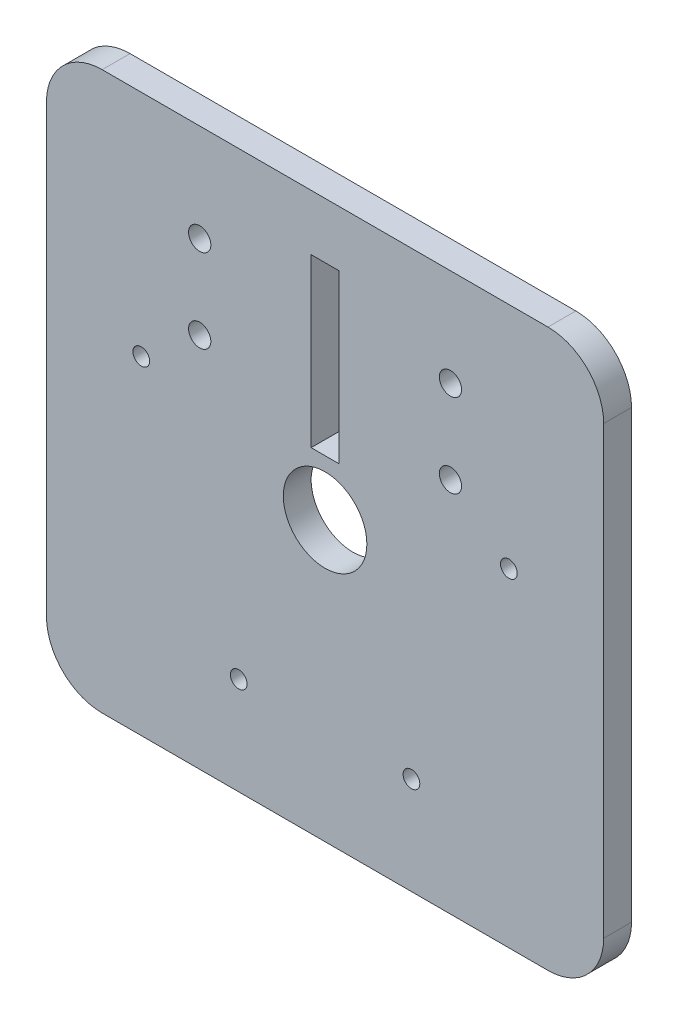
from build123d import *

# Parameters (mm, degrees)
CROQUIS1_W              = 100
CROQUIS1_H              = 100
CROQUIS1_R              = 7.5
CROQUIS1_W_2            = 5
CROQUIS1_H_2            = 30
SALIENTE_EXTRUIR1_DEPTH = 5
REDONDEO1_R             = 10
CROQUIS3_R              = 1.5
CROQUIS3_R_2            = 1.500000006
CORTAR_EXTRUIR1_DEPTH   = 5
CORTAR_EXTRUIR2_REACH   = 144.377
CROQUIS4_R              = 2


with BuildPart() as part:
    # Croquis1 → Saliente-Extruir1 (new body)
    with BuildSketch(Plane.XY):
        with Locations((-73.773233416, -20.188160544)):
            Rectangle(CROQUIS1_W, CROQUIS1_H)
        with Locations((-73.773233416, -20.188160544)):
            Circle(CROQUIS1_R, mode=Mode.SUBTRACT)
        with Locations((-73.773233416, 4.811839456)):
            Rectangle(CROQUIS1_W_2, CROQUIS1_H_2, mode=Mode.SUBTRACT)
    extrude(amount=SALIENTE_EXTRUIR1_DEPTH)

    # Redondeo1
    redondeo1_edges = [part.edges().sort_by_distance(p)[0] for p in [
        (-23.773233416, 29.811839456, 2.5),
        (-23.773233416, -70.188160544, 2.5),
        (-123.773233416, -70.188160544, 2.5),
        (-123.773233416, 29.811839456, 2.5),
    ]]
    fillet(redondeo1_edges, radius=REDONDEO1_R)

    # Croquis3 → Cortar-Extruir1 (cut)
    with BuildSketch(Plane(origin=(0, 0, 0), x_dir=(-1, 0, 0), z_dir=(0, 0, -1))):
        with Locations((106.757827558, -11.251647632)):
            Circle(CROQUIS3_R)
        with Locations((40.788639233, -11.251647632)):
            Circle(CROQUIS3_R_2)
        with Locations((89.273233395, -52.688161005)):
            Circle(CROQUIS3_R)
        with Locations((58.273233395, -52.688161005)):
            Circle(CROQUIS3_R)
    extrude(amount=-CORTAR_EXTRUIR1_DEPTH, mode=Mode.SUBTRACT)

    # Croquis4 → Cortar-Extruir2 (cut, up to next)
    with BuildSketch(Plane.XY.offset(5), mode=Mode.PRIVATE) as cortar_extruir2_sk1:
        with Locations((-51.273233416, 12.311839456)):
            Circle(CROQUIS4_R)
    cortar_extruir2_tool1 = extrude(cortar_extruir2_sk1.sketch, amount=-CORTAR_EXTRUIR2_REACH, mode=Mode.PRIVATE) & part.part
    # Croquis4 → Cortar-Extruir2 (cut, up to next)
    with BuildSketch(Plane.XY.offset(5), mode=Mode.PRIVATE) as cortar_extruir2_sk2:
        with Locations(Location((-96.273233416, 12.311839456, 0), (0, 0, 180))):
            Circle(CROQUIS4_R)
    cortar_extruir2_tool2 = extrude(cortar_extruir2_sk2.sketch, amount=-CORTAR_EXTRUIR2_REACH, mode=Mode.PRIVATE) & part.part
    # Croquis4 → Cortar-Extruir2 (cut, up to next)
    with BuildSketch(Plane.XY.offset(5), mode=Mode.PRIVATE) as cortar_extruir2_sk3:
        with Locations((-96.273233416, -2.688160544)):
            Circle(CROQUIS4_R)
    cortar_extruir2_tool3 = extrude(cortar_extruir2_sk3.sketch, amount=-CORTAR_EXTRUIR2_REACH, mode=Mode.PRIVATE) & part.part
    # Croquis4 → Cortar-Extruir2 (cut, up to next)
    with BuildSketch(Plane.XY.offset(5), mode=Mode.PRIVATE) as cortar_extruir2_sk4:
        with Locations(Location((-51.273233416, -2.688160544, 0), (0, 0, 180))):
            Circle(CROQUIS4_R)
    cortar_extruir2_tool4 = extrude(cortar_extruir2_sk4.sketch, amount=-CORTAR_EXTRUIR2_REACH, mode=Mode.PRIVATE) & part.part
    add(cortar_extruir2_tool1.solids().sort_by_distance((-51.273233, 12.311839, 5))[0], mode=Mode.SUBTRACT)
    add(cortar_extruir2_tool2.solids().sort_by_distance((-96.273233, 12.311839, 5))[0], mode=Mode.SUBTRACT)
    add(cortar_extruir2_tool3.solids().sort_by_distance((-96.273233, -2.688161, 5))[0], mode=Mode.SUBTRACT)
    add(cortar_extruir2_tool4.solids().sort_by_distance((-51.273233, -2.688161, 5))[0], mode=Mode.SUBTRACT)


solid = part.part
